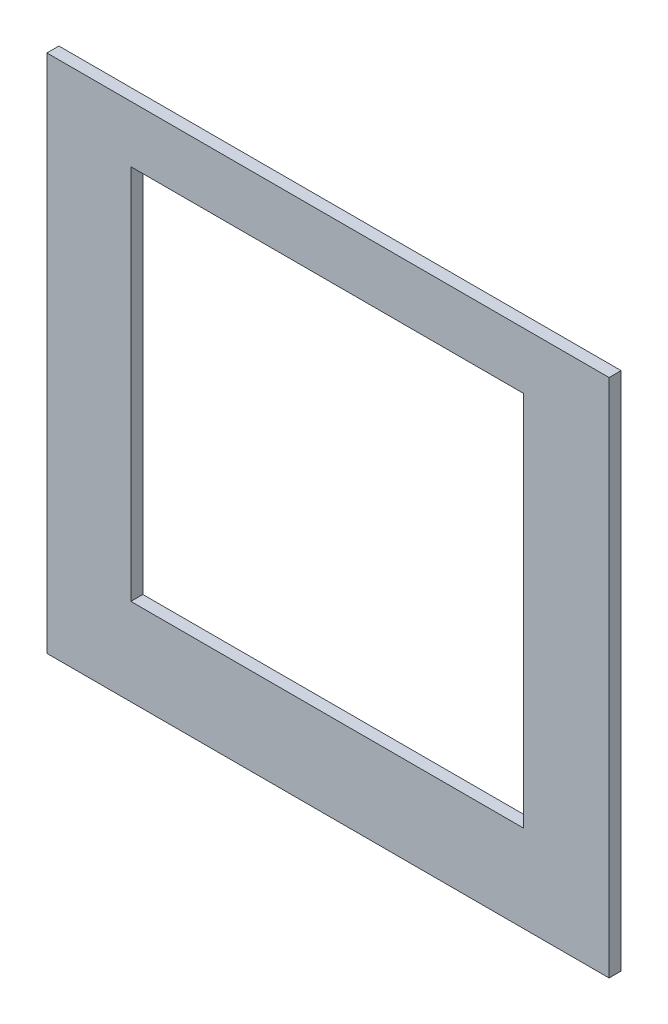
from build123d import *

# Parameters (mm, degrees)
SKETCH2_W           = 892.45948
SKETCH2_H           = 825.5
SKETCH2_W_2         = 623.433997163
SKETCH2_H_2         = 597.607170609
BOSS_EXTRUDE1_DEPTH = 19.05


with BuildPart() as part:
    # Sketch2 → Boss-Extrude1 (new body)
    with BuildSketch(Plane.XY):
        with Locations((2350.735344961, 2389.107671121)):
            Rectangle(SKETCH2_W, SKETCH2_H)
        with Locations((2349.461133434, 2413.296655929)):
            Rectangle(SKETCH2_W_2, SKETCH2_H_2, mode=Mode.SUBTRACT)
    extrude(amount=BOSS_EXTRUDE1_DEPTH)


solid = part.part
